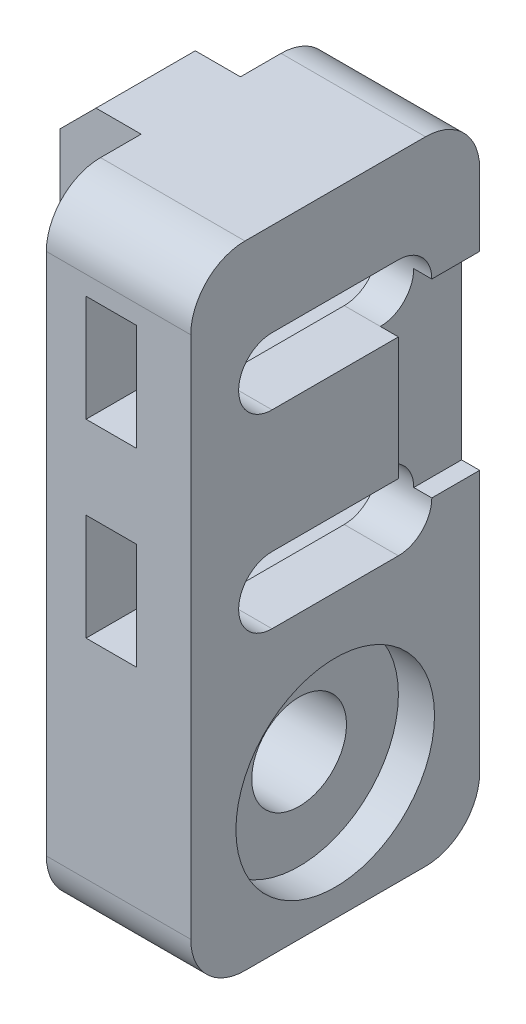
from build123d import *

# Parameters (mm, degrees)
SKETCH1_W           = 16
SKETCH1_H           = 35
BOSS_EXTRUDE1_DEPTH = 8
SKETCH2_W           = 5.5
SKETCH2_H           = 18.925407089
BOSS_EXTRUDE2_DEPTH = 4.5
CHAMFER1_SIZE       = 2
CUT_EXTRUDE1_START  = -3
SKETCH7_W           = 16
SKETCH7_H           = 5.9
CUT_EXTRUDE1_DEPTH  = 2.8
CUT_EXTRUDE2_DEPTH  = 5
SKETCH9_W           = 4.5
SKETCH9_H           = 10.5
CUT_EXTRUDE3_DEPTH  = 1
FILLET7_R           = 3
SKETCH10_R          = 2.625
CUT_EXTRUDE4_DEPTH  = 20
SKETCH11_R          = 5.5
CUT_EXTRUDE5_DEPTH  = 2


with BuildPart() as part:
    # Sketch1 → Boss-Extrude1 (new body)
    with BuildSketch(Plane(origin=(0, 0, 0), x_dir=(0, 0, -1), z_dir=(1, 0, 0))):
        with Locations((-40.846556001, 15.41146402)):
            Rectangle(SKETCH1_W, SKETCH1_H)
    extrude(amount=BOSS_EXTRUDE1_DEPTH)

    # Sketch2 → Boss-Extrude2 (add)
    with BuildSketch(Plane.ZY):
        with Locations((40.846556001, 23.448760476)):
            Rectangle(SKETCH2_W, SKETCH2_H)
    extrude(amount=BOSS_EXTRUDE2_DEPTH)

    # Chamfer1
    chamfer1_edges = [part.edges().sort_by_distance(p)[0] for p in [
        (-4.5, 13.986056931, 40.846556001),
        (-4.5, 32.91146402, 40.846556001),
    ]]
    chamfer(chamfer1_edges, length=CHAMFER1_SIZE)

    # Sketch7 → Cut-Extrude1 (cut)
    with BuildSketch(Plane(origin=(8, 0, 0), x_dir=(0, 0, -1), z_dir=(1, 0, 0)).offset(CUT_EXTRUDE1_START)):
        with Locations((-40.846556001, 25.91146402)):
            Rectangle(SKETCH7_W, SKETCH7_H)
        with Locations((-40.846556001, 15.41146402)):
            Rectangle(SKETCH7_W, SKETCH7_H)
    extrude(amount=-CUT_EXTRUDE1_DEPTH, mode=Mode.SUBTRACT)

    # Sketch8 → Cut-Extrude2 (cut)
    with BuildSketch(Plane(origin=(8, 0, 0), x_dir=(0, 0, -1), z_dir=(1, 0, 0))):
        with BuildLine():
            Line((-44.346556001, 27.76146402), (-37.346556001, 27.76146402))
            ThreePointArc((-37.346556001, 27.76146402), (-35.496556001, 25.91146402), (-37.346556001, 24.06146402))
            Line((-37.346556001, 24.06146402), (-44.346556001, 24.06146402))
            ThreePointArc((-44.346556001, 24.06146402), (-46.196556001, 25.91146402), (-44.346556001, 27.76146402))
        make_face()
        with BuildLine():
            Line((-44.346556001, 17.26146402), (-37.346556001, 17.26146402))
            ThreePointArc((-37.346556001, 17.26146402), (-35.496556001, 15.41146402), (-37.346556001, 13.56146402))
            Line((-37.346556001, 13.56146402), (-44.346556001, 13.56146402))
            ThreePointArc((-44.346556001, 13.56146402), (-46.196556001, 15.41146402), (-44.346556001, 17.26146402))
        make_face()
    extrude(amount=-CUT_EXTRUDE2_DEPTH, mode=Mode.SUBTRACT)

    # Sketch9 → Cut-Extrude3 (cut)
    with BuildSketch(Plane(origin=(8, 0, 0), x_dir=(0, 0, -1), z_dir=(1, 0, 0))):
        with Locations((-35.096556001, 20.66146402)):
            Rectangle(SKETCH9_W, SKETCH9_H)
    extrude(amount=-CUT_EXTRUDE3_DEPTH, mode=Mode.SUBTRACT)

    # Fillet7
    fillet7_edges = [part.edges().sort_by_distance(p)[0] for p in [
        (4, 32.91146402, 32.846556001),
        (4, 32.91146402, 48.846556001),
        (4, -2.08853598, 48.846556001),
        (4, -2.08853598, 32.846556001),
    ]]
    fillet(fillet7_edges, radius=FILLET7_R)

    # Sketch10 → Cut-Extrude4 (cut)
    with BuildSketch(Plane(origin=(8, 0, 0), x_dir=(0, 0, -1), z_dir=(1, 0, 0))):
        with Locations((-40.846556001, 4.91146402)):
            Circle(SKETCH10_R)
    extrude(amount=-CUT_EXTRUDE4_DEPTH, mode=Mode.SUBTRACT)

    # Sketch11 → Cut-Extrude5 (cut)
    with BuildSketch(Plane(origin=(8, 0, 0), x_dir=(0, 0, -1), z_dir=(1, 0, 0))):
        with Locations((-40.846556001, 4.91146402)):
            Circle(SKETCH11_R)
    extrude(amount=-CUT_EXTRUDE5_DEPTH, mode=Mode.SUBTRACT)


solid = part.part
